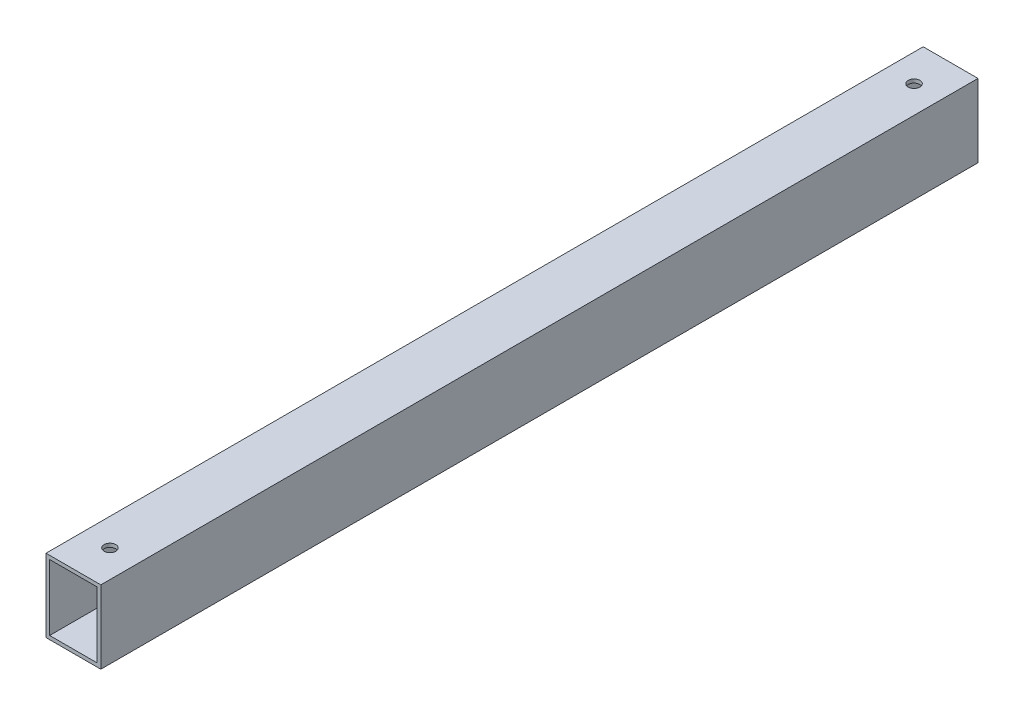
from build123d import *

# Parameters (mm, degrees)
SKETCH_1_W          = 15
SKETCH_1_H          = 20
SKETCH_1_W_2        = 13
SKETCH_1_H_2        = 18
EXTRUDE_1_DEPTH     = 240
SKETCH_3_R          = 1.6
CUT_EXTRUDE_2_DEPTH = 242.29857024


with BuildPart() as part:
    # 草图1 → 拉伸-薄壁1 (new body)
    with BuildSketch(Plane.XY):
        with Locations((7.5, -10)):
            Rectangle(SKETCH_1_W, SKETCH_1_H)
        with Locations((7.5, -10)):
            Rectangle(SKETCH_1_W_2, SKETCH_1_H_2, mode=Mode.SUBTRACT)
    extrude(amount=EXTRUDE_1_DEPTH)

    # 草图3 → 切除-拉伸2 (cut, through all)
    with BuildSketch(Plane(origin=(0, 0, 0), x_dir=(1, 0, 0), z_dir=(0, 1, 0))):
        with Locations(Location((7.5, -10, 0), (0, 0, 270))):
            Circle(SKETCH_3_R)
        with Locations(Location((7.5, -230, 0), (0, 0, 270))):
            Circle(SKETCH_3_R)
    extrude(amount=-CUT_EXTRUDE_2_DEPTH, mode=Mode.SUBTRACT)


solid = part.part
